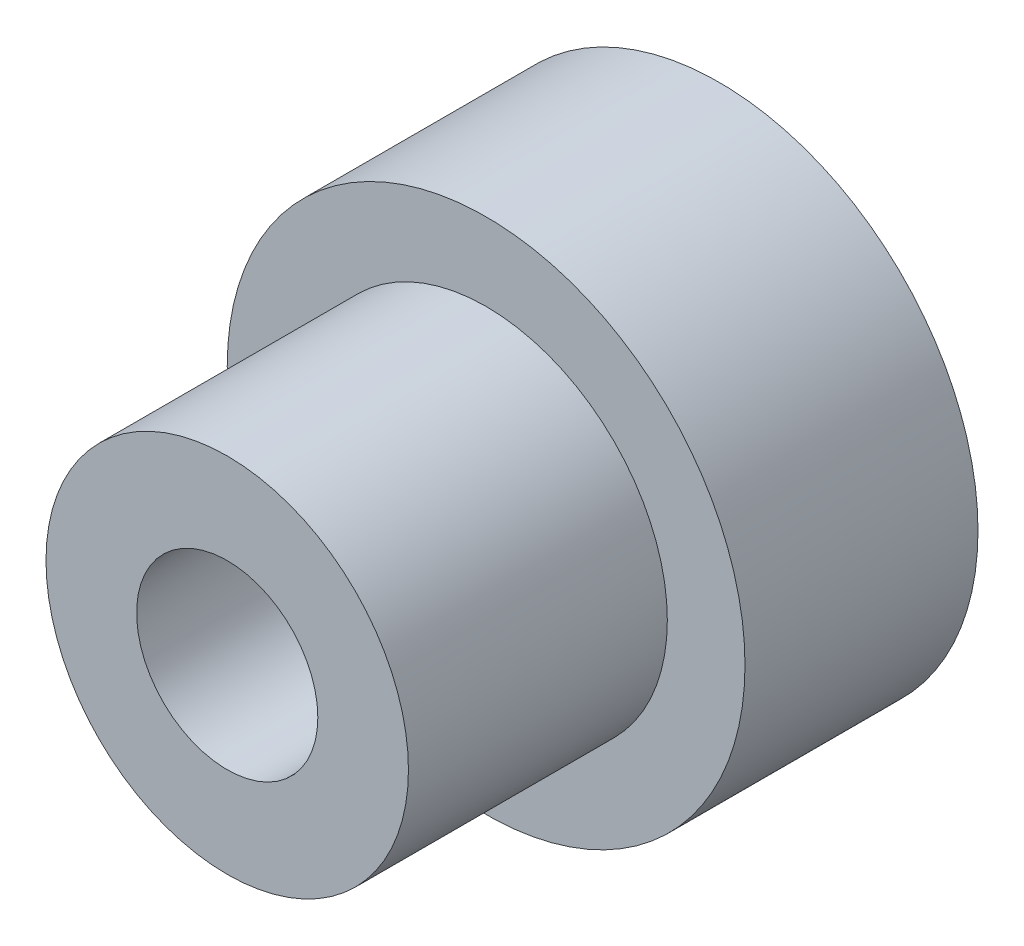
from build123d import *

# Parameters (mm, degrees)
SKETCH_2_R          = 7
EXTRUDE_1_DEPTH     = 10
SKETCH_3_R          = 10
EXTRUDE_2_DEPTH     = 9
SKETCH_4_R          = 3.5
CUT_EXTRUDE_1_DEPTH = 24.685438565
CUT_EXTRUDE_START   = -13
SKETCH_5_R          = 5.5
CUT_EXTRUDE_2_DEPTH = 2.5


with BuildPart() as part:
    # Эскиз2 → Бобышка-Вытянуть1 (new body)
    with BuildSketch(Plane.XY):
        Circle(SKETCH_2_R)
    extrude(amount=EXTRUDE_1_DEPTH)

    # Эскиз3 → Бобышка-Вытянуть2 (add)
    with BuildSketch(Plane(origin=(0, 0, 0), x_dir=(-1, 0, 0), z_dir=(0, 0, -1))):
        Circle(SKETCH_3_R)
    extrude(amount=EXTRUDE_2_DEPTH)

    # Эскиз4 → Вырез-Вытянуть1 (cut, through all)
    with BuildSketch(Plane.XY.offset(10)):
        Circle(SKETCH_4_R)
    extrude(amount=-CUT_EXTRUDE_1_DEPTH, mode=Mode.SUBTRACT)

    # Эскиз5 → Вырез-Вытянуть2 (cut)
    with BuildSketch(Plane.XY.offset(10).offset(CUT_EXTRUDE_START)):
        Circle(SKETCH_5_R)
    extrude(amount=-CUT_EXTRUDE_2_DEPTH, mode=Mode.SUBTRACT)


solid = part.part
